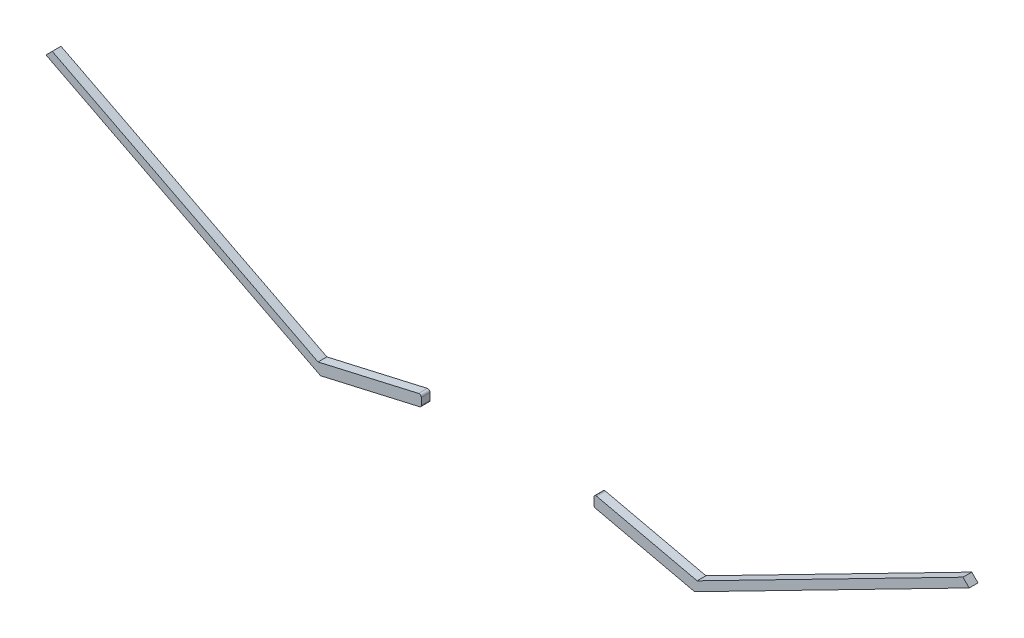
from build123d import *

# Parameters (mm, degrees)
EXTRUDE_1_DEPTH   = 2
EXTRUDE_1_2_DEPTH = 2


with BuildPart() as part:
    # 스케치1 → 보스-돌출1 (new body)
    with BuildSketch(Plane.XY):
        with BuildLine():
            Line((-103.485281374, 16.676935339), (-43.075853619, -14.244090721))
            Line((-43.075853619, -14.244090721), (-20.223148332, -9.012633862))
            ThreePointArc((-20.223148332, -9.012633862), (-19.799955074, -9.109010075), (-19.611574166, -9.500026112))
            Line((-19.611574166, -9.500026112), (-19.611574166, -11.038827765))
            ThreePointArc((-19.611574166, -11.038827765), (-19.720558129, -11.350446857), (-20, -11.526220015))
            Line((-20, -11.526220015), (-42.5, -16.676935339))
            Line((-42.5, -16.676935339), (-104.899494937, 15.262721777))
            Line((-104.899494937, 15.262721777), (-103.485281374, 16.676935339))
        make_face()
    extrude(amount=EXTRUDE_1_DEPTH)


with BuildPart() as body_2:
    # 스케치1 → Extrude 1 2 (new body)
    with BuildSketch(Plane.XY):
        with BuildLine():
            Line((104.899494937, 15.262721777), (103.485281374, 16.676935339))
            Line((103.485281374, 16.676935339), (43.075853619, -14.244090721))
            Line((43.075853619, -14.244090721), (20.223148332, -9.012633862))
            ThreePointArc((20.223148332, -9.012633862), (19.799955074, -9.109010075), (19.611574166, -9.500026112))
            Line((19.611574166, -9.500026112), (19.611574166, -11.038827765))
            ThreePointArc((19.611574166, -11.038827765), (19.720558129, -11.350446857), (20, -11.526220015))
            Line((20, -11.526220015), (42.5, -16.676935339))
            Line((42.5, -16.676935339), (104.899494937, 15.262721777))
        make_face()
    extrude(amount=EXTRUDE_1_2_DEPTH)


solid = Compound([part.part, body_2.part])
